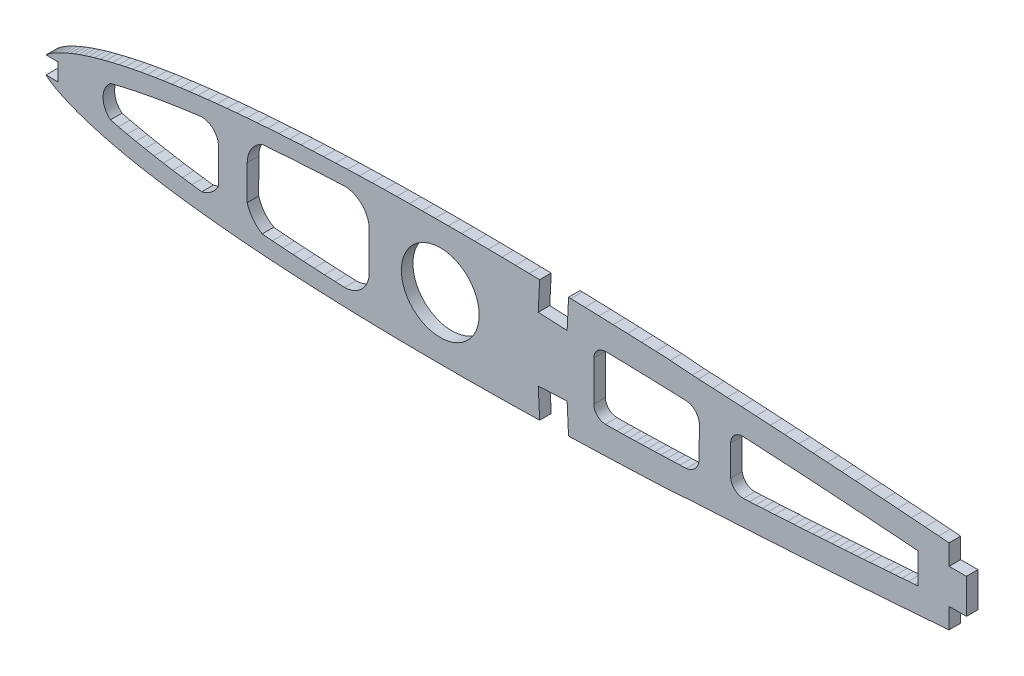
from build123d import *

# Parameters (mm, degrees)
MODEL_R         = 6.72573464
EXTRUDE_1_DEPTH = 2


with BuildPart() as part:
    # Model → 凸台-拉伸1 (new body)
    with BuildSketch(Plane.XY):
        Polygon((13.461005555, 11.504996715), (15.501995815, 11.504996715), (15.501995815, 14.504996715), (13.462216594, 14.504996715), (13.810995815, 14.792996715), (14.201995815, 15.077996715), (14.607995815, 15.342996715), (15.138995815, 15.654996715), (15.682995815, 15.942996715), (16.235995815, 16.212996715), (16.922995815, 16.527996715), (17.616995815, 16.825996715), (18.317995815, 17.106996715), (19.153995815, 17.417996715), (19.996995815, 17.708996715), (20.846995815, 17.981996715), (21.830995815, 18.276996715), (22.819995815, 18.553996715), (23.812995815, 18.815996715), (24.938995815, 19.094996715), (26.068995815, 19.358996715), (27.202995815, 19.606996715), (28.465995815, 19.866996715), (29.732995815, 20.111996715), (31.002995815, 20.341996715), (32.398995815, 20.579996715), (33.796995815, 20.803996715), (35.197995815, 21.013996715), (36.721995815, 21.228996715), (38.245995815, 21.429996715), (39.772995815, 21.617996715), (41.418995815, 21.806996715), (43.064995815, 21.983996715), (44.711995815, 22.147996715), (46.470995815, 22.311996715), (48.229995815, 22.463996715), (49.990995815, 22.603996715), (51.856995815, 22.741996715), (53.722995815, 22.867996715), (55.590995815, 22.981996715), (57.556995815, 23.091996715), (59.522995815, 23.190996715), (61.489995815, 23.279996715), (63.547995815, 23.361996715), (65.605995815, 23.434996715), (67.664995815, 23.497996715), (69.806995815, 23.553996715), (71.947995815, 23.600996715), (74.089995815, 23.637996715), (76.306995815, 23.667996715), (78.523995815, 23.687996715), (80.741995815, 23.699996715), (83.026995815, 23.703996715), (85.309995815, 23.699996715), (87.594995815, 23.687996715), (89.935995815, 23.667996715), (92.276995815, 23.640996715), (94.617995815, 23.604996715), (97.007995815, 23.560996715), (98.81532888, 23.523170573), (98.57332888, 18.529170573), (103.56832888, 18.287170573), (103.80932888, 23.281170573), (103.804746934, 23.3989972), (104.215995815, 23.387996715), (106.644995815, 23.316996715), (109.073995815, 23.238996715), (111.531995815, 23.153996715), (113.988995815, 23.062996715), (116.446995815, 22.965996715), (118.924995815, 22.862996715), (121.402995815, 22.753996715), (125.203742352, 22.445633191), (126.266954145, 22.391745546), (128.753954145, 22.259745546), (131.240954145, 22.121745546), (133.727954145, 21.979745546), (136.214954145, 21.834745546), (138.692954145, 21.687745546), (141.170954145, 21.537745546), (143.648954145, 21.382745546), (146.107954145, 21.223745546), (148.564954145, 21.060745546), (151.021954145, 20.893745546), (153.451954145, 20.724745546), (155.879954145, 20.553745546), (158.309954145, 20.379745546), (160.698954145, 20.204745546), (163.087954145, 20.026745546), (165.477954145, 19.844745546), (167.819954145, 19.664745546), (169.612009696, 19.524597612), (169.612009696, 16.005009316), (172.612009696, 16.005009316), (172.612009696, 10.005009316), (169.612009696, 10.005009316), (169.612009696, 6.480659316), (167.819954145, 6.339745546), (165.477954145, 6.159745546), (163.087954145, 5.977745546), (160.698954145, 5.799745546), (158.309954145, 5.624745546), (155.879954145, 5.450745546), (153.451954145, 5.279745546), (151.021954145, 5.111745546), (148.564954145, 4.943745546), (146.107954145, 4.780745546), (143.648954145, 4.621745546), (141.170954145, 4.466745546), (138.692954145, 4.316745546), (136.214954145, 4.169745546), (133.727954145, 4.024745546), (131.240954145, 3.882745546), (128.753954145, 3.744745546), (126.266954145, 3.612745546), (125.20388514, 3.558865138), (121.402995815, 3.254996715), (118.924995815, 3.146996715), (116.446995815, 3.042996715), (113.988995815, 2.945996715), (111.531995815, 2.854996715), (109.073995815, 2.769996715), (106.644995815, 2.691996715), (104.215995815, 2.620996715), (103.81284707, 2.610212901), (103.56865924, 7.722586433), (98.57365924, 7.480586433), (98.81565924, 2.486586433), (97.007995815, 2.447996715), (94.617995815, 2.403996715), (92.276995815, 2.368996715), (89.935995815, 2.340996715), (87.594995815, 2.320996715), (85.309995815, 2.308996715), (83.026995815, 2.304996715), (80.741995815, 2.308996715), (78.523995815, 2.320996715), (76.306995815, 2.340996715), (74.089995815, 2.370996715), (71.947995815, 2.407996715), (69.806995815, 2.454996715), (67.664995815, 2.510996715), (65.605995815, 2.573996715), (63.547995815, 2.646996715), (61.489995815, 2.729996715), (59.522995815, 2.817996715), (57.556995815, 2.916996715), (55.590995815, 3.026996715), (53.722995815, 3.141996715), (51.856995815, 3.266996715), (49.990995815, 3.404996715), (48.229995815, 3.544996715), (46.470995815, 3.696996715), (44.711995815, 3.860996715), (43.064995815, 4.025996715), (41.418995815, 4.201996715), (39.772995815, 4.390996715), (38.245995815, 4.578996715), (36.721995815, 4.779996715), (35.197995815, 4.994996715), (33.796995815, 5.204996715), (32.398995815, 5.428996715), (31.002995815, 5.666996715), (29.732995815, 5.897996715), (28.465995815, 6.141996715), (27.202995815, 6.401996715), (26.068995815, 6.649996715), (24.938995815, 6.913996715), (23.812995815, 7.192996715), (22.819995815, 7.454996715), (21.830995815, 7.731996715), (20.846995815, 8.027996715), (19.996995815, 8.299996715), (19.153995815, 8.590996715), (18.317995815, 8.901996715), (17.616995815, 9.182996715), (16.922995815, 9.480996715), (16.235995815, 9.795996715), (15.682995815, 10.065996715), (15.138995815, 10.353996715), (14.607995815, 10.665996715), (14.201995815, 10.930996715), (13.810995815, 11.215996715), align=None)
        with Locations((81.633227779, 13.004996715)):
            Circle(MODEL_R, mode=Mode.SUBTRACT)
        with BuildLine():
            Line((24.59827358, 15.812660569), (26.008021936, 16.165097658))
            Line((26.008021936, 16.165097658), (27.495307212, 16.508686986))
            Line((27.495307212, 16.508686986), (28.997821627, 16.832901047))
            Line((28.997821627, 16.832901047), (30.55637271, 17.144611264))
            Line((30.55637271, 17.144611264), (32.134322901, 17.439555225))
            Line((32.134322901, 17.439555225), (33.749457912, 17.722696271))
            Line((33.749457912, 17.722696271), (35.369150363, 17.986080909))
            Line((35.369150363, 17.986080909), (37.029786279, 18.23678977))
            Line((37.029786279, 18.23678977), (38.701504336, 18.47382442))
            Line((38.701504336, 18.47382442), (40.396934947, 18.698550126))
            ThreePointArc((40.396934947, 18.698550126), (42.437630785, 17.811855821), (43.288592247, 15.756002985))
            Line((43.288592247, 15.756002985), (43.288592247, 9.780080526))
            ThreePointArc((43.288592247, 9.780080526), (42.10303511, 8.302257873), (40.396934947, 7.478408524))
            Line((40.396934947, 7.478408524), (38.701504336, 7.703134231))
            Line((38.701504336, 7.703134231), (37.029786279, 7.940168881))
            Line((37.029786279, 7.940168881), (35.369150363, 8.190877741))
            Line((35.369150363, 8.190877741), (33.749457912, 8.45426238))
            Line((33.749457912, 8.45426238), (32.134322901, 8.737403426))
            Line((32.134322901, 8.737403426), (30.55637271, 9.032347387))
            Line((30.55637271, 9.032347387), (28.997821627, 9.344057604))
            Line((28.997821627, 9.344057604), (27.495307212, 9.668271664))
            Line((27.495307212, 9.668271664), (26.008021936, 10.011860993))
            Line((26.008021936, 10.011860993), (24.59827358, 10.364298082))
            ThreePointArc((24.59827358, 10.364298082), (23.326590775, 13.088479325), (24.59827358, 15.812660569))
        make_face(mode=Mode.SUBTRACT)
        with BuildLine():
            Line((50.82908143, 19.787662365), (52.604118205, 19.929462735))
            Line((52.604118205, 19.929462735), (54.395422317, 20.064128151))
            Line((54.395422317, 20.064128151), (56.181698977, 20.188280713))
            Line((56.181698977, 20.188280713), (57.983427056, 20.302635809))
            Line((57.983427056, 20.302635809), (59.793946228, 20.409736944))
            Line((59.793946228, 20.409736944), (61.604458938, 20.508908286))
            Line((61.604458938, 20.508908286), (63.422992931, 20.598177135))
            Line((63.422992931, 20.598177135), (65.096002922, 20.675392981))
            ThreePointArc((65.096002922, 20.675392981), (68.106347385, 19.381749538), (69.346918853, 16.349148414))
            Line((69.346918853, 16.349148414), (69.346918853, 9.827810237))
            ThreePointArc((69.346918853, 9.827810237), (68.106347385, 6.795209113), (65.096002921, 5.50156567))
            Line((65.096002921, 5.50156567), (63.422992931, 5.578781515))
            Line((63.422992931, 5.578781515), (61.604458938, 5.668050365))
            Line((61.604458938, 5.668050365), (59.793946228, 5.767221707))
            Line((59.793946228, 5.767221707), (57.983427056, 5.874322841))
            Line((57.983427056, 5.874322841), (56.181698977, 5.988677938))
            Line((56.181698977, 5.988677938), (54.395422317, 6.1128305))
            Line((54.395422317, 6.1128305), (52.604118205, 6.247495916))
            Line((52.604118205, 6.247495916), (50.82908143, 6.389296286))
            ThreePointArc((50.82908143, 6.389296286), (49.21840915, 7.842576159), (48.242517552, 9.780080526))
            Line((48.242517552, 9.780080526), (48.254555804, 15.774416861))
            ThreePointArc((48.254555804, 15.774416861), (48.957954297, 18.15559274), (50.82908143, 19.787662365))
        make_face(mode=Mode.SUBTRACT)
        with BuildLine():
            Line((164.229802072, 15.630862898), (163.67794974, 15.674051335))
            Line((163.67794974, 15.674051335), (162.58051605, 15.758835001))
            Line((162.58051605, 15.758835001), (161.481491631, 15.842547416))
            Line((161.481491631, 15.842547416), (160.378691631, 15.925347416))
            Line((160.378691631, 15.925347416), (159.277779885, 16.009203588))
            Line((159.277779885, 16.009203588), (158.18064556, 16.090384365))
            Line((158.18064556, 16.090384365), (157.079734572, 16.170646646))
            Line((157.079734572, 16.170646646), (155.97868804, 16.250918809))
            Line((155.97868804, 16.250918809), (154.88086723, 16.329847103))
            Line((154.88086723, 16.329847103), (153.780092991, 16.407703822))
            Line((153.780092991, 16.407703822), (152.68201006, 16.485454782))
            Line((152.68201006, 16.485454782), (151.584195351, 16.560795007))
            Line((151.584195351, 16.560795007), (150.483418197, 16.636256326))
            Line((150.483418197, 16.636256326), (149.385475118, 16.710409344))
            Line((149.385475118, 16.710409344), (148.28766264, 16.783357668))
            Line((148.28766264, 16.783357668), (147.189729086, 16.855118031))
            Line((147.189729086, 16.855118031), (146.093118203, 16.925674238))
            Line((146.093118203, 16.925674238), (144.995430027, 16.995027086))
            Line((144.995430027, 16.995027086), (143.895725245, 17.063309409))
            Line((143.895725245, 17.063309409), (142.798998616, 17.131481067))
            Line((142.798998616, 17.131481067), (141.703092698, 17.197139919))
            Line((141.703092698, 17.197139919), (140.604477358, 17.261834824))
            Line((140.604477358, 17.261834824), (139.507874866, 17.326411198))
            Line((139.507874866, 17.326411198), (138.413172196, 17.388488121))
            Line((138.413172196, 17.388488121), (137.316571348, 17.449476827))
            Line((137.316571348, 17.449476827), (136.219971182, 17.509269639))
            Line((136.219971182, 17.509269639), (135.125272266, 17.567765001))
            Line((135.125272266, 17.567765001), (134.028673641, 17.623970165))
            ThreePointArc((134.028673641, 17.623970165), (132.496674158, 17.059234117), (131.838580126, 15.564957883))
            Line((131.838580126, 15.564957883), (131.838580126, 10.311980122))
            ThreePointArc((131.838580126, 10.311980122), (132.565457539, 8.930331188), (134.028673641, 8.385993804))
            Line((134.028673641, 8.385993804), (135.125272266, 8.442198968))
            Line((135.125272266, 8.442198968), (136.219971182, 8.50069433))
            Line((136.219971182, 8.50069433), (137.316571348, 8.560487142))
            Line((137.316571348, 8.560487142), (138.413172196, 8.621475848))
            Line((138.413172196, 8.621475848), (139.507874866, 8.683552771))
            Line((139.507874866, 8.683552771), (140.604477358, 8.748129145))
            Line((140.604477358, 8.748129145), (141.703092698, 8.81282405))
            Line((141.703092698, 8.81282405), (142.798998616, 8.878482902))
            Line((142.798998616, 8.878482902), (143.895725245, 8.94665456))
            Line((143.895725245, 8.94665456), (144.995430027, 9.014936883))
            Line((144.995430027, 9.014936883), (146.093118203, 9.084289731))
            Line((146.093118203, 9.084289731), (147.189729086, 9.154845938))
            Line((147.189729086, 9.154845938), (148.28766264, 9.226606301))
            Line((148.28766264, 9.226606301), (149.385475118, 9.299554625))
            Line((149.385475118, 9.299554625), (150.483418197, 9.373707643))
            Line((150.483418197, 9.373707643), (151.584195351, 9.449168962))
            Line((151.584195351, 9.449168962), (152.68201006, 9.524509187))
            Line((152.68201006, 9.524509187), (153.780092991, 9.602260146))
            Line((153.780092991, 9.602260146), (154.88086723, 9.680116866))
            Line((154.88086723, 9.680116866), (155.97868804, 9.75904516))
            Line((155.97868804, 9.75904516), (157.079734572, 9.839317323))
            Line((157.079734572, 9.839317323), (158.18064556, 9.919579604))
            Line((158.18064556, 9.919579604), (159.277779885, 10.000760381))
            Line((159.277779885, 10.000760381), (160.378691631, 10.084616553))
            Line((160.378691631, 10.084616553), (161.481491631, 10.167416553))
            Line((161.481491631, 10.167416553), (162.58051605, 10.251128968))
            Line((162.58051605, 10.251128968), (163.67794974, 10.335912633))
            Line((163.67794974, 10.335912633), (164.226912015, 10.378874892))
            Line((164.226912015, 10.378874892), (164.229802072, 15.630862898))
        make_face(mode=Mode.SUBTRACT)
        with BuildLine():
            Line((124.141273444, 18.074532086), (121.988151222, 18.154451469))
            Line((121.988151222, 18.154451469), (120.895807343, 18.19265366))
            Line((120.895807343, 18.19265366), (119.80353539, 18.229659595))
            Line((119.80353539, 18.229659595), (118.711264257, 18.264278024))
            Line((118.711264257, 18.264278024), (117.617084026, 18.297761135))
            Line((117.617084026, 18.297761135), (116.52667463, 18.32993715))
            Line((116.52667463, 18.32993715), (115.437468475, 18.358537749))
            Line((115.437468475, 18.358537749), (114.344448066, 18.386042639))
            Line((114.344448066, 18.386042639), (113.254587202, 18.412304347))
            Line((113.254587202, 18.412304347), (112.165448714, 18.436136699))
            Line((112.165448714, 18.436136699), (111.077469354, 18.457586456))
            Line((111.077469354, 18.457586456), (110.226167557, 18.472505217))
            ThreePointArc((110.226167557, 18.472505217), (108.789354734, 17.899361911), (108.19112365, 16.472812259))
            Line((108.19112365, 16.472812259), (108.19112365, 9.57384123))
            ThreePointArc((108.19112365, 9.57384123), (108.776910087, 8.159627667), (110.19112365, 7.57384123))
            Line((110.19112365, 7.57384123), (112.16608666, 7.57384123))
            Line((112.16608666, 7.57384123), (113.254587202, 7.597659622))
            Line((113.254587202, 7.597659622), (114.344448066, 7.62392133))
            Line((114.344448066, 7.62392133), (115.437468475, 7.65142622))
            Line((115.437468475, 7.65142622), (116.52667463, 7.680026819))
            Line((116.52667463, 7.680026819), (117.617084026, 7.712202834))
            Line((117.617084026, 7.712202834), (118.711264257, 7.745685945))
            Line((118.711264257, 7.745685945), (119.80353539, 7.780304374))
            Line((119.80353539, 7.780304374), (120.895807343, 7.817310309))
            Line((120.895807343, 7.817310309), (121.988151222, 7.855512499))
            Line((121.988151222, 7.855512499), (123.081625145, 7.896099959))
            Line((123.081625145, 7.896099959), (124.173906485, 7.937881213))
            ThreePointArc((124.173906485, 7.937881213), (125.782559629, 8.80319671), (126.386552587, 10.527066878))
            Line((126.386552587, 10.527066878), (126.434300804, 15.564957883))
            ThreePointArc((126.434300804, 15.564957883), (125.790557601, 17.279132261), (124.141273444, 18.074532086))
        make_face(mode=Mode.SUBTRACT)
    extrude(amount=EXTRUDE_1_DEPTH)


solid = part.part
